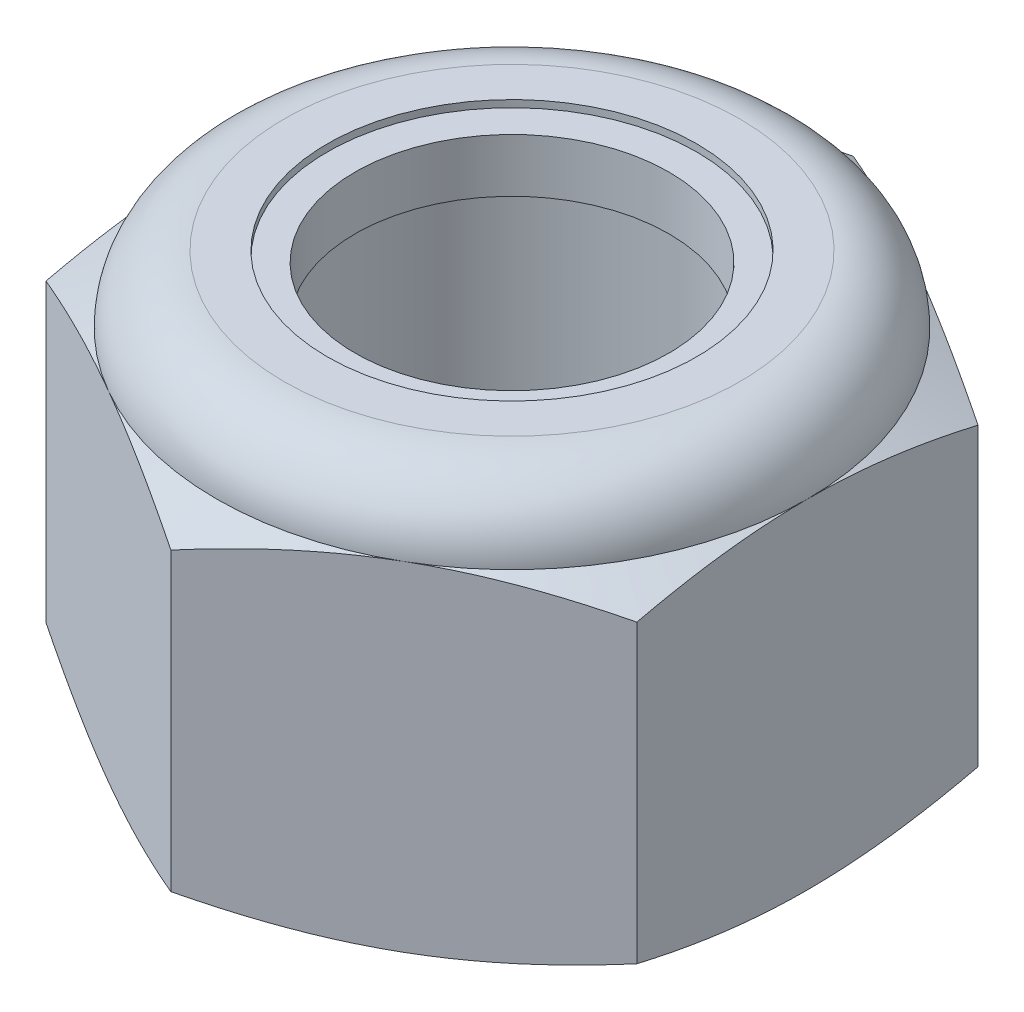
from build123d import *

# Parameters (mm, degrees)
SKETCH13_R     = 3.96875
EXTRUDE1_DEPTH = 8.73125


with BuildPart() as part:
    # Sketch13 → Extrude1 (new body)
    with BuildSketch(Plane(origin=(0, 0, 0), x_dir=(1, 0, 0), z_dir=(0, 1, 0))):
        Polygon((0, 7.332348419), (-6.35, 3.666174209), (-6.35, -3.666174209), (0, -7.332348419), (6.35, -3.666174209), (6.35, 3.666174209), align=None)
        with Locations(Location((0, 0, 0), (0, 0, 270))):
            Circle(SKETCH13_R, mode=Mode.SUBTRACT)
    extrude(amount=EXTRUDE1_DEPTH)

    # Sketch5 → Cut-Revolve3 (revolve, cut)
    with BuildSketch(Plane(origin=(0, 0, 0), x_dir=(0, 0, -1), z_dir=(1, 0, 0))):
        with BuildLine():
            Line((0, 0), (6.35, 0))
            Line((6.35, 0), (7.332348419, 0.458076591))
            Line((7.332348419, 0.458076591), (7.332348419, 6.817965076))
            Line((7.332348419, 6.817965076), (6.35, 7.276041667))
            ThreePointArc((6.35, 7.276041667), (5.923779347, 8.305029347), (4.894791667, 8.73125))
            Line((4.894791667, 8.73125), (4.894791667, 10.00125))
            Line((4.894791667, 10.00125), (8.602348419, 10.00125))
            Line((8.602348419, 10.00125), (8.602348419, -1.27))
            Line((8.602348419, -1.27), (0, -1.27))
            Line((0, -1.27), (0, 0))
        make_face()
    revolve(axis=Axis((0, 0, 0), (0, 1, 0)), mode=Mode.SUBTRACT)

    # Sketch6 → Cut-Revolve4 (revolve, cut)
    with BuildSketch(Plane(origin=(0, 0, 0), x_dir=(0, 0, -1), z_dir=(1, 0, 0)), mode=Mode.PRIVATE) as cut_revolve4_sk:
        with BuildLine():
            Line((0, 7.276041667), (6.1976, 7.276041667))
            ThreePointArc((6.1976, 7.276041667), (5.816016274, 8.197266274), (4.894791667, 8.57885))
            Line((4.894791667, 8.57885), (2.447395833, 8.57885))
            Line((2.447395833, 8.57885), (2.447395833, 10.00125))
            Line((2.447395833, 10.00125), (0, 10.00125))
            Line((0, 10.00125), (0, 7.276041667))
        make_face()
    revolve(cut_revolve4_sk.sketch.rotate(Axis((0, 10.00125, 0), (0, -1, 0)), 180), axis=Axis((0, 10.00125, 0), (0, -1, 0)), mode=Mode.SUBTRACT)

    # Sketch4 → Cut-Revolve2 (revolve, cut)
    with BuildSketch(Plane(origin=(0, 0, 0), x_dir=(0, 0, -1), z_dir=(1, 0, 0))):
        Polygon((0, 7.276041667), (4.365625, 7.276041667), (0, 5.240317297), align=None)
        Polygon((0, 2.03572437), (4.365625, 0), (0, 0), align=None)
    revolve(axis=Axis((0, 0, 0), (0, 1, 0)), mode=Mode.SUBTRACT)


with BuildPart() as body_2:
    # Sketch7 → Revolve2 (revolve)
    with BuildSketch(Plane(origin=(0, 0, 0), x_dir=(0, 0, -1), z_dir=(1, 0, 0))):
        with BuildLine():
            Line((3.3734375, 7.352241667), (6.119030844, 7.352241667))
            ThreePointArc((6.119030844, 7.352241667), (5.734762038, 8.169919611), (4.894791667, 8.50265))
            Line((4.894791667, 8.50265), (3.3734375, 8.50265))
            Line((3.3734375, 8.50265), (3.3734375, 7.352241667))
        make_face()
    revolve(axis=Axis((0, 7.352241667, 0), (0, 1, 0)))


solid = Compound([part.part, body_2.part])
